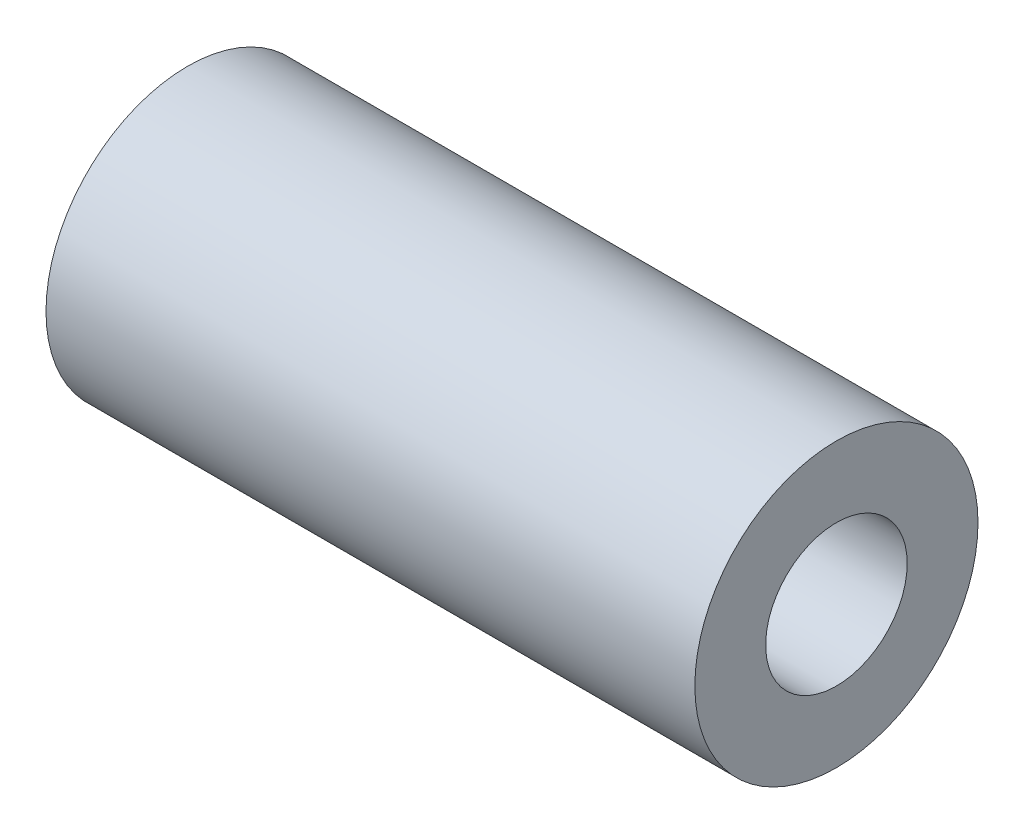
from build123d import *

# Parameters (mm, degrees)
SKETCH1_R           = 2.4
SKETCH1_R_2         = 1.2
BOSS_EXTRUDE1_DEPTH = 11


with BuildPart() as part:
    # Sketch1 → Boss-Extrude1 (new body)
    with BuildSketch(Plane(origin=(0, 0, 0), x_dir=(0, 0, -1), z_dir=(1, 0, 0))):
        Circle(SKETCH1_R)
        Circle(SKETCH1_R_2, mode=Mode.SUBTRACT)
    extrude(amount=-BOSS_EXTRUDE1_DEPTH)


solid = part.part
